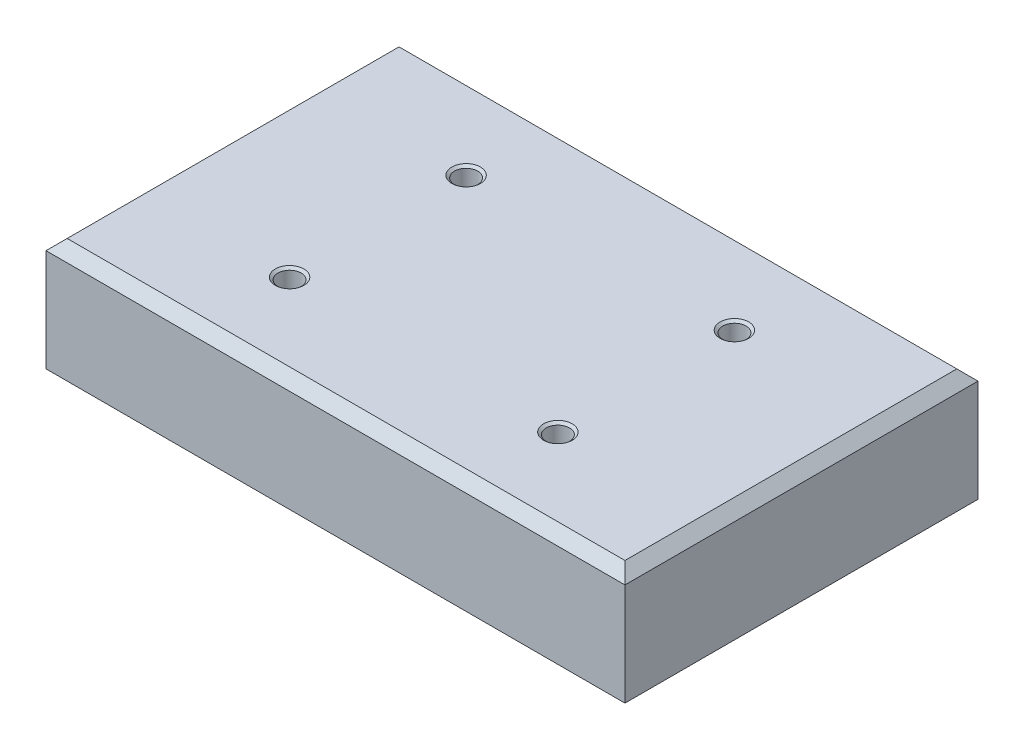
from build123d import *

# Parameters (mm, degrees)
SKETCH1_W                   = 82
SKETCH1_H                   = 50
BOSS_EXTRUDE1_DEPTH         = 16
CHAMFER1_SIZE               = 1.5
CHAMFER2_SIZE               = 1.5
CHAMFER3_SIZE               = 1.5
CHAMFER4_SIZE               = 1.5
M4_TAPPED_HOLE4_D           = 3.3
M4_TAPPED_HOLE4_DEPTH       = 8
M4_TAPPED_HOLE4_CSINK_D     = 4.05
M4_TAPPED_HOLE4_CSINK_ANGLE = 100
M4_TAPPED_HOLE4_TIP         = 0.991420021


with BuildPart() as part:
    # Sketch1 → Boss-Extrude1 (new body)
    with BuildSketch(Plane(origin=(0, 0, 0), x_dir=(1, 0, 0), z_dir=(0, 1, 0))):
        Rectangle(SKETCH1_W, SKETCH1_H)
    extrude(amount=BOSS_EXTRUDE1_DEPTH)

    # Chamfer1
    chamfer1_edges = [part.edges().sort_by_distance(p)[0] for p in [
        (-41, 16, 0),
    ]]
    chamfer(chamfer1_edges, length=CHAMFER1_SIZE)

    # Chamfer2
    chamfer2_edges = [part.edges().sort_by_distance(p)[0] for p in [
        (0.75, 16, 25),
    ]]
    chamfer(chamfer2_edges, length=CHAMFER2_SIZE)

    # Chamfer3
    chamfer3_edges = [part.edges().sort_by_distance(p)[0] for p in [
        (41, 16, -0.75),
    ]]
    chamfer(chamfer3_edges, length=CHAMFER3_SIZE)

    # Chamfer4
    chamfer4_edges = [part.edges().sort_by_distance(p)[0] for p in [
        (0, 16, -25),
    ]]
    chamfer(chamfer4_edges, length=CHAMFER4_SIZE)

    # M4 Tapped Hole4
    with Locations(Plane(origin=(0, 16, 0), x_dir=(1, 0, 0), z_dir=(0, 1, 0))):
        with Locations((-19, 12.5), (19, 12.5), (19, -12.5), (-19, -12.5)):
            CounterSinkHole(M4_TAPPED_HOLE4_D / 2, M4_TAPPED_HOLE4_CSINK_D / 2, depth=M4_TAPPED_HOLE4_DEPTH, counter_sink_angle=M4_TAPPED_HOLE4_CSINK_ANGLE)
            with Locations((0, 0, -(M4_TAPPED_HOLE4_DEPTH + M4_TAPPED_HOLE4_TIP / 2))):  # 118° drill point
                Cone(0, M4_TAPPED_HOLE4_D / 2, M4_TAPPED_HOLE4_TIP, mode=Mode.SUBTRACT)


solid = part.part
